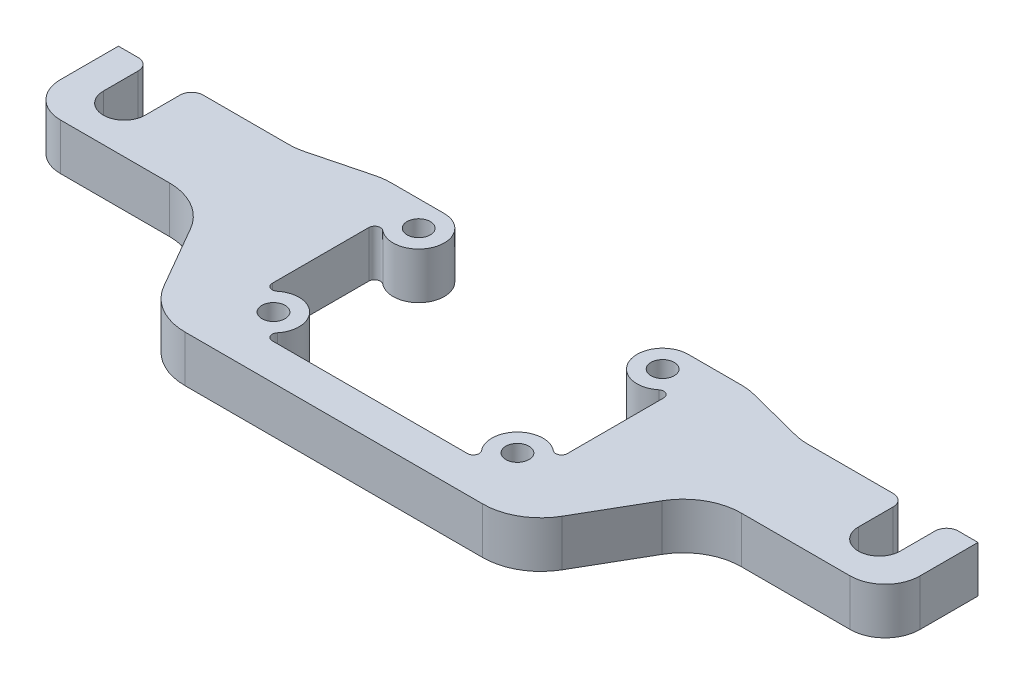
from build123d import *

# Parameters (mm, degrees)
BOSS_EXTRUDE1_DEPTH      = 10
SKETCH2_OUTSIDE_W        = 47.45
SKETCH2_OUTSIDE_H        = 30.449999999999996
CUT_EXTRUDE1_DEPTH       = 20
F_2_0MM_DOWEL_HOLE1_D    = 2
M3_CLEARANCE_HOLE1_D     = 3.6
M3_CLEARANCE_HOLE1_DEPTH = 4
M3_CLEARANCE_HOLE1_TIP   = 1.0815491142496085
FILLET2_R                = 3
FILLET3_R                = 5
FILLET5_R                = 0.5
CUT_EXTRUDE2_REACH       = 40.536
SKETCH14_W               = 3.6000000000000014
SKETCH14_H               = 4
FILLET6_R                = 1


with BuildPart() as part:
    # Sketch1 → Boss-Extrude1 (new, symmetric)
    with BuildSketch(Plane.XY):
        Polygon((0, 0), (0, 4), (-37, 3.9999999999999956), (-37, 0), align=None)
    extrude(amount=BOSS_EXTRUDE1_DEPTH, both=True)

    # Sketch2 outside → Cut-Extrude1 (cut)
    with BuildSketch(Plane.XZ):
        with Locations((-18.5, 0)):
            Rectangle(SKETCH2_OUTSIDE_W, SKETCH2_OUTSIDE_H)
        with BuildLine():
            Line((-12.7, -7.800000000000001), (-12.699999999999998, 4.7))
            ThreePointArc((-12.699999999999998, 4.7), (-8.944365081389599, 3.144365081389597), (-10.5, 6.899999999999999))
            Line((-10.5, 6.899999999999999), (3.8e-16, 6.9))
            Line((3.8e-16, 6.9), (0, 10))
            Line((0, 10), (-15.699999999999996, 10.000000000000002))
            Line((-15.699999999999996, 10.000000000000002), (-21.733310313031556, -0.449999999999999))
            Line((-21.733310313031556, -0.449999999999999), (-37, -0.4499999999999973))
            Line((-37, -0.4499999999999973), (-37, -8.450000000000001))
            Line((-37, -8.450000000000001), (-21.733310313031556, -8.45))
            Line((-21.733310313031556, -8.45), (-15.699999999999996, -10.000000000000002))
            Line((-15.699999999999996, -10.000000000000002), (-10.499999999999998, -9.999999999999998))
            ThreePointArc((-10.499999999999998, -9.999999999999998), (-8.944365081389593, -6.244365081389596), (-12.7, -7.800000000000001))
        make_face(mode=Mode.SUBTRACT)
    extrude(amount=-CUT_EXTRUDE1_DEPTH, mode=Mode.SUBTRACT)

    # Ø2.0mm Dowel Hole1 (through all)
    with Locations(Plane(origin=(0, 0, 0), x_dir=(-1, 0, 0), z_dir=(0, -1, 0))):
        with Locations((10.5, -4.7), (10.5, 7.8)):
            Hole(F_2_0MM_DOWEL_HOLE1_D / 2)

    # M3 Clearance Hole1
    with Locations(Plane(origin=(0, 0, 0), x_dir=(-1, 0, 0), z_dir=(0, -1, 0))):
        with Locations((32.5, 4.45)):
            Hole(M3_CLEARANCE_HOLE1_D / 2, depth=M3_CLEARANCE_HOLE1_DEPTH)
            with Locations((0, 0, -(M3_CLEARANCE_HOLE1_DEPTH + M3_CLEARANCE_HOLE1_TIP / 2))):  # 118° drill point
                Cone(0, M3_CLEARANCE_HOLE1_D / 2, M3_CLEARANCE_HOLE1_TIP, mode=Mode.SUBTRACT)

    # Fillet2
    fillet2_edges = [part.edges().sort_by_distance(p)[0] for p in [
        (-37, 1.9999999999999978, -0.4499999999999973),
    ]]
    fillet(fillet2_edges, radius=FILLET2_R)

    # Fillet3
    fillet3_edges = [part.edges().sort_by_distance(p)[0] for p in [
        (-15.699999999999996, 1.9999999999999991, 10.000000000000002),
        (-15.699999999999996, 1.9999999999999991, -10.000000000000002),
        (-21.733310313031556, 1.9999999999999987, -0.449999999999999),
        (-21.733310313031556, 1.9999999999999987, -8.45),
    ]]
    fillet(fillet3_edges, radius=FILLET3_R)

    # Fillet5
    fillet5_edges = [part.edges().sort_by_distance(p)[0] for p in [
        (-10.5, 1.9999999999999993, 6.899999999999999),
        (-12.699999999999998, 1.9999999999999993, 4.7),
        (-12.7, 1.9999999999999993, -7.800000000000001),
    ]]
    fillet(fillet5_edges, radius=FILLET5_R)

    # Sketch14 → Cut-Extrude2 (cut, up to next)
    with BuildSketch(Plane.XZ, mode=Mode.PRIVATE) as cut_extrude2_sk1:
        with Locations((-32.5, -6.449999999999999)):
            Rectangle(SKETCH14_W, SKETCH14_H)
    cut_extrude2_tool1 = extrude(cut_extrude2_sk1.sketch, amount=-CUT_EXTRUDE2_REACH, mode=Mode.PRIVATE) & part.part
    add(cut_extrude2_tool1.solids().sort_by_distance((-32.5, 0, -6.45))[0], mode=Mode.SUBTRACT)

    # Fillet6
    fillet6_edges = [part.edges().sort_by_distance(p)[0] for p in [
        (-30.700000000000003, 1.9999999999999982, -8.45),
        (-34.300000000000004, 1.999999999999998, -8.45),
    ]]
    fillet(fillet6_edges, radius=FILLET6_R)

    # Mirror1: part across plane


with BuildPart() as part_1:
    add(part.part)
    add(part.part.mirror(Plane(origin=(0, 0, -10), x_dir=(0, 0, 1), z_dir=(1, 0, 0))))


solid = part_1.part
